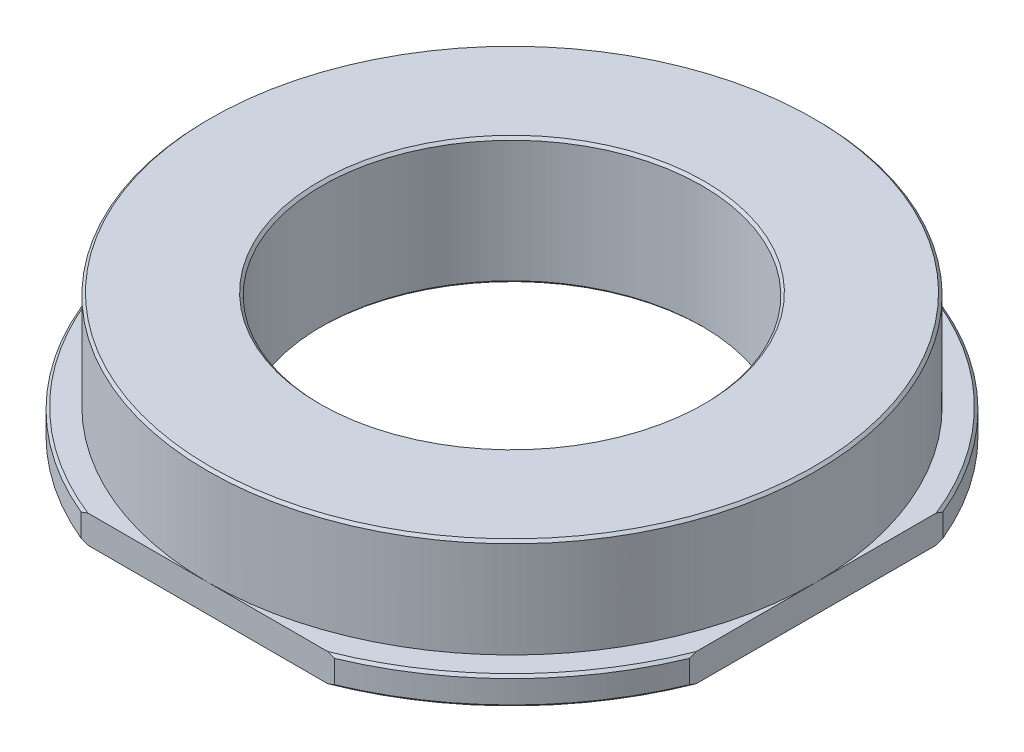
from build123d import *

# Parameters (mm, degrees)
SKETCH_1_R          = 13
EXTRUDE_1_DEPTH     = 1.1
SKETCH_2_R          = 12
EXTRUDE_2_DEPTH     = 3.9
SKETCH_3_R          = 7.5
CUT_EXTRUDE_1_DEPTH = 20.052558883
CHAMFER_1_SIZE      = 0.1
CUT_EXTRUDE_2_DEPTH = 19.793881983


with BuildPart() as part:
    # 草图1 → 凸台-拉伸1 (new body)
    with BuildSketch(Plane(origin=(0, 0, 0), x_dir=(1, 0, 0), z_dir=(0, 1, 0))):
        with Locations(Location((0, 0, 0), (0, 0, 270))):
            Circle(SKETCH_1_R)
    extrude(amount=EXTRUDE_1_DEPTH)

    # 草图2 → 凸台-拉伸2 (add)
    with BuildSketch(Plane(origin=(0, 1.1, 0), x_dir=(1, 0, 0), z_dir=(0, 1, 0))):
        with Locations(Location((0, 0, 0), (0, 0, 270))):
            Circle(SKETCH_2_R)
    extrude(amount=EXTRUDE_2_DEPTH)

    # 草图3 → 切除-拉伸1 (cut, through all)
    with BuildSketch(Plane(origin=(0, 5, 0), x_dir=(1, 0, 0), z_dir=(0, 1, 0))):
        with Locations(Location((0, 0, 0), (0, 0, 270))):
            Circle(SKETCH_3_R)
    extrude(amount=-CUT_EXTRUDE_1_DEPTH, mode=Mode.SUBTRACT)

    # 倒角1
    chamfer_1_edges = [part.edges().sort_by_distance(p)[0] for p in [
        (0, 0, -7.5),
        (0, 5, -7.5),
        (0, 0, -13),
        (0, 1.1, -13),
        (0, 5, -12),
    ]]
    chamfer(chamfer_1_edges, length=CHAMFER_1_SIZE)

    # 草图7 → 切除-拉伸2 (cut, through all)
    with BuildSketch(Plane(origin=(0, 1.1, 0), x_dir=(1, 0, 0), z_dir=(0, 1, 0))):
        with BuildLine():
            Line((-5, 12), (5, 12))
            ThreePointArc((5, 12), (0, 13), (-5, 12))
        make_face()
        with BuildLine():
            Line((-12, 5), (-12, -5))
            ThreePointArc((-12, -5), (-13, 0), (-12, 5))
        make_face()
        with BuildLine():
            Line((-5, -12), (5, -12))
            ThreePointArc((5, -12), (0, -13), (-5, -12))
        make_face()
        with BuildLine():
            Line((12, 5), (12, -5))
            ThreePointArc((12, -5), (13, 0), (12, 5))
        make_face()
    extrude(amount=-CUT_EXTRUDE_2_DEPTH, mode=Mode.SUBTRACT)


solid = part.part
